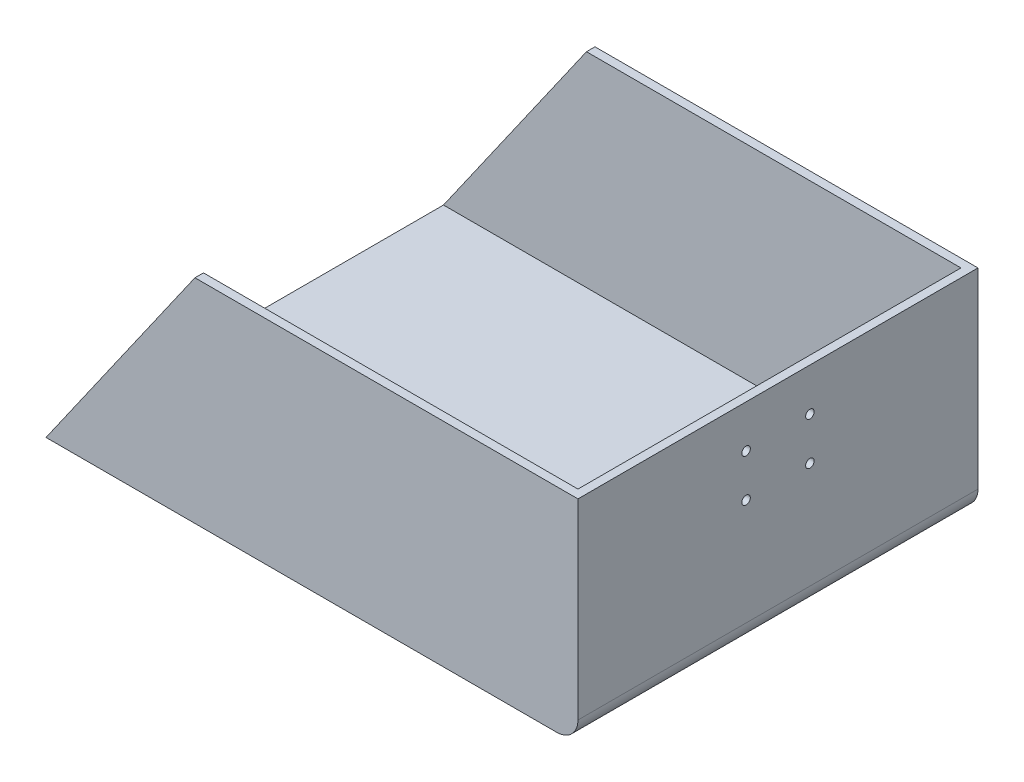
from build123d import *

# Parameters (mm, degrees)
DODANIE_WYCI_GNI_CIE1_DEPTH = 188
SKORUPA1_T                  = -4
SZKIC2_R                    = 2
WYTNIJ_WYCI_GNI_CIE1_DEPTH  = 120


with BuildPart() as part:
    # Szkic1 → Dodanie-wyciągnięcie1 (new body)
    with BuildSketch(Plane.XY):
        with BuildLine():
            Line((-10, 0), (-250, 0))
            Line((-250, 0), (-180, 100))
            Line((-180, 100), (0, 100))
            Line((0, 100), (0, 10))
            ThreePointArc((0, 10), (-2.928932188, 2.928932188), (-10, 0))
        make_face()
    extrude(amount=DODANIE_WYCI_GNI_CIE1_DEPTH)

    # Skorupa1
    skorupa1_openings = [part.faces().sort_by_distance(p)[0] for p in [
        (-90, 100, 94),
        (-215, 50, 94),
    ]]
    offset(amount=SKORUPA1_T, openings=skorupa1_openings, kind=Kind.INTERSECTION)

    # Szkic2 → Wytnij-wyciągnięcie1 (cut)
    with BuildSketch(Plane(origin=(0, 0, 0), x_dir=(0, 0, -1), z_dir=(1, 0, 0))):
        with Locations((-109, 80)):
            Circle(SZKIC2_R)
        with Locations((-79, 80)):
            Circle(SZKIC2_R)
        with Locations((-79, 60)):
            Circle(SZKIC2_R)
        with Locations((-109, 60)):
            Circle(SZKIC2_R)
    extrude(amount=-WYTNIJ_WYCI_GNI_CIE1_DEPTH, mode=Mode.SUBTRACT)


solid = part.part
